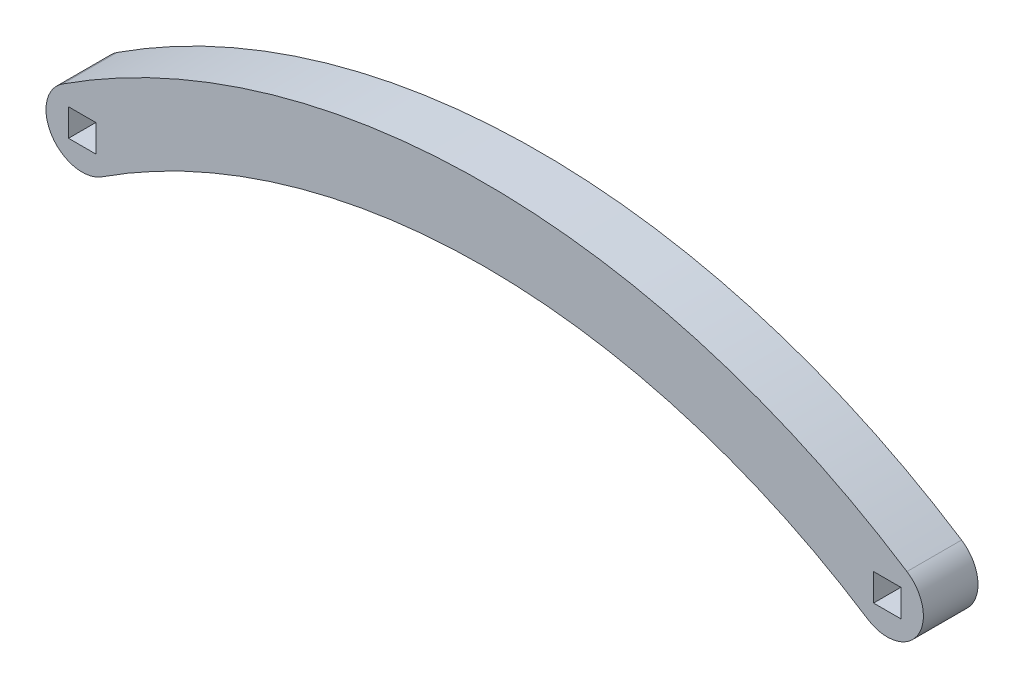
from build123d import *

# Parameters (mm, degrees)
SKETCH1_W           = 3.175
SKETCH1_H           = 3.175
BOSS_EXTRUDE1_DEPTH = 6.35


with BuildPart() as part:
    # Sketch1 → Boss-Extrude1 (new body)
    with BuildSketch(Plane.XY):
        with BuildLine():
            ThreePointArc((95.894192869, 3.526467972), (46.7995, 18.096007393), (-2.295192869, 3.526467972))
            ThreePointArc((-2.295192869, 3.526467972), (-3.526467972, -2.295192869), (2.295192869, -3.526467972))
            ThreePointArc((2.295192869, -3.526467972), (46.7995, 9.68081003), (91.303807131, -3.526467972))
            ThreePointArc((91.303807131, -3.526467972), (97.125467972, -2.295192869), (95.894192869, 3.526467972))
        make_face()
        with Locations((93.599, 0)):
            Rectangle(SKETCH1_W, SKETCH1_H, mode=Mode.SUBTRACT)
        Rectangle(SKETCH1_W, SKETCH1_H, mode=Mode.SUBTRACT)
    extrude(amount=BOSS_EXTRUDE1_DEPTH)


solid = part.part
